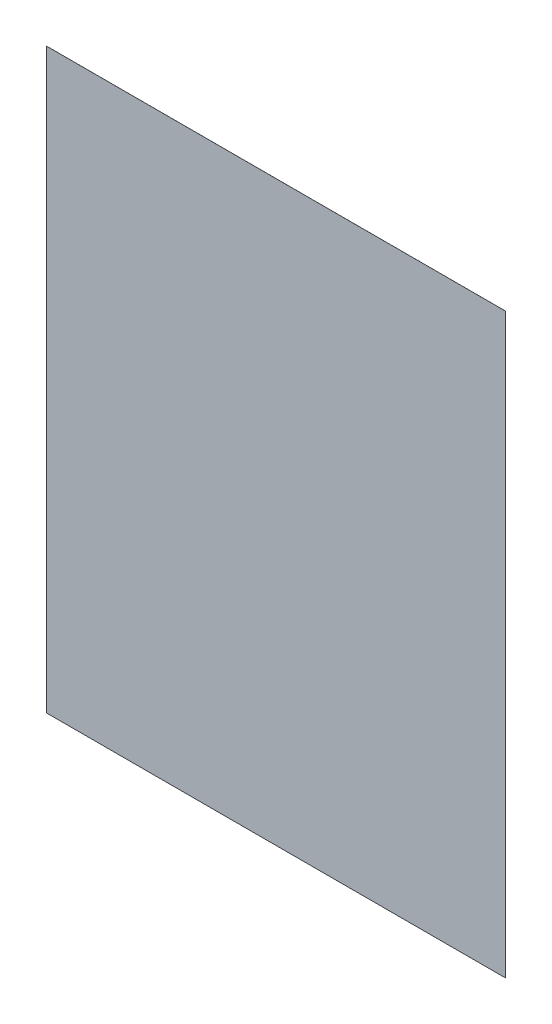
from build123d import *

# Parameters (mm, degrees)
SKETCH_1_W      = 3.3415
SKETCH_1_H      = 4.2032
EXTRUDE_1_DEPTH = 0.00025


with BuildPart() as part:
    # 草图1 → 凸台-拉伸1 (new body)
    with BuildSketch(Plane.XY):
        with Locations((-0.08185, 0)):
            Rectangle(SKETCH_1_W, SKETCH_1_H)
    extrude(amount=EXTRUDE_1_DEPTH)


solid = part.part
